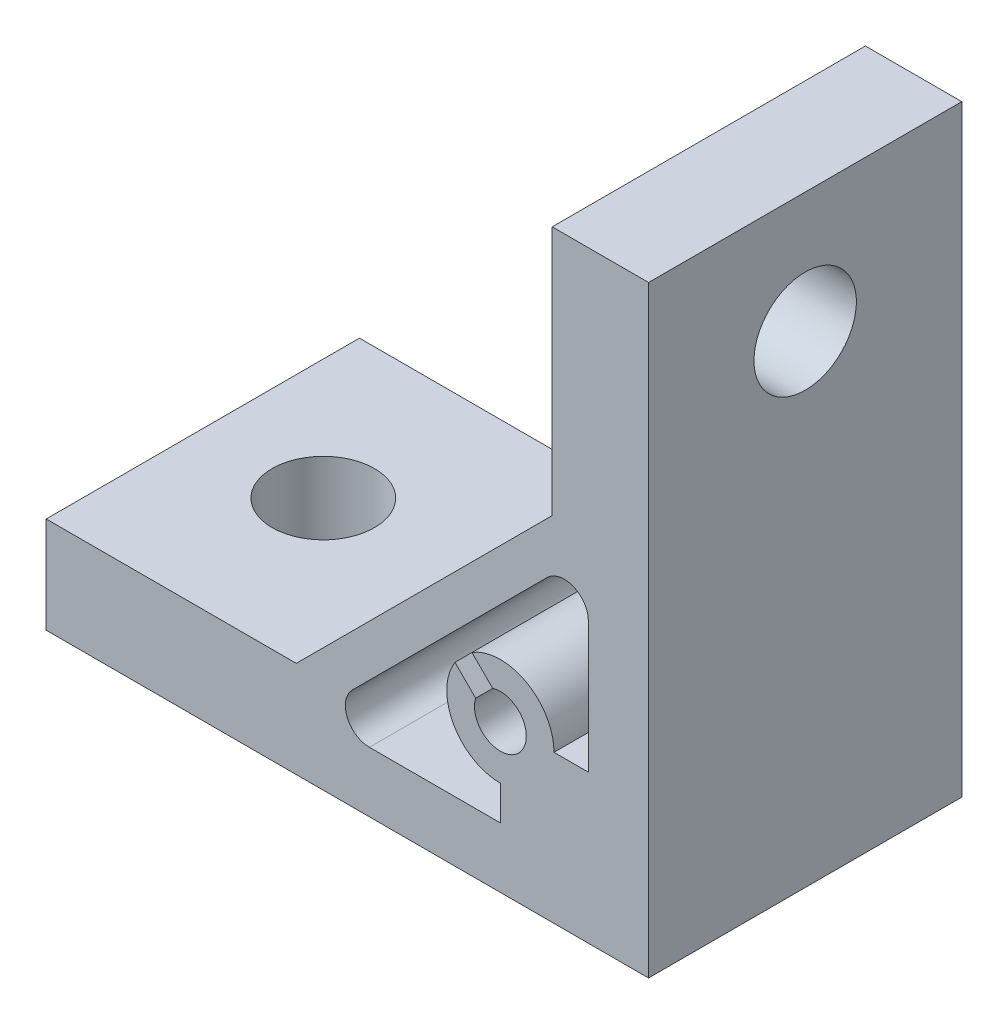
from build123d import *

# Parameters (mm, degrees)
EXTRUDE_1_DEPTH     = 13
SKETCH_3_R          = 4.25
CUT_EXTRUDE_1_DEPTH = 67.580778007


with BuildPart() as part:
    # 草图1 → 凸台-拉伸1 (new, symmetric)
    with BuildSketch(Plane.XY):
        Polygon((0, 0), (50, 0), (50, 50), (42, 50), (42, 29.242640687), (20.757359313, 8), (0, 8), align=None)
        with BuildLine():
            Line((37.061279898, 14.352933665), (35.340960992, 16.07325257))
            ThreePointArc((35.340960992, 16.07325257), (39.856939547, 16.192314452), (42.15, 12.3))
            Line((42.15, 12.3), (45, 12.3))
            Line((45, 12.3), (45, 23.171572875))
            ThreePointArc((45, 23.171572875), (43.765366865, 25.01933194), (41.585786438, 24.585786438))
            Line((41.585786438, 24.585786438), (25.414213562, 8.414213562))
            ThreePointArc((25.414213562, 8.414213562), (24.98066806, 6.234633135), (26.828427125, 5))
            Line((26.828427125, 5), (37.7, 5))
            Line((37.7, 5), (37.7, 7.85))
            ThreePointArc((37.7, 7.85), (33.807685548, 10.143060453), (33.92674743, 14.659039008))
            Line((33.92674743, 14.659039008), (35.647066335, 12.938720102))
            ThreePointArc((35.647066335, 12.938720102), (39.22027958, 10.77972042), (37.061279898, 14.352933665))
        make_face(mode=Mode.SUBTRACT)
    extrude(amount=EXTRUDE_1_DEPTH, both=True)

    # 草图3 → 切除-拉伸1 (cut, through all)
    with BuildSketch(Plane(origin=(0, 8, 0), x_dir=(1, 0, 0), z_dir=(0, 1, 0))):
        with Locations(Location((10, 0, 0), (0, 0, 270))):
            Circle(SKETCH_3_R)
    cut_extrude_1 = extrude(amount=-CUT_EXTRUDE_1_DEPTH, mode=Mode.SUBTRACT)

    # 镜向1: 切除-拉伸1 across plane
    add(cut_extrude_1.mirror(Plane(origin=(25, 25, 0), x_dir=(0, 0, 1), z_dir=(-0.7071067811865489, -0.7071067811865462, 0))), mode=Mode.SUBTRACT)


solid = part.part
